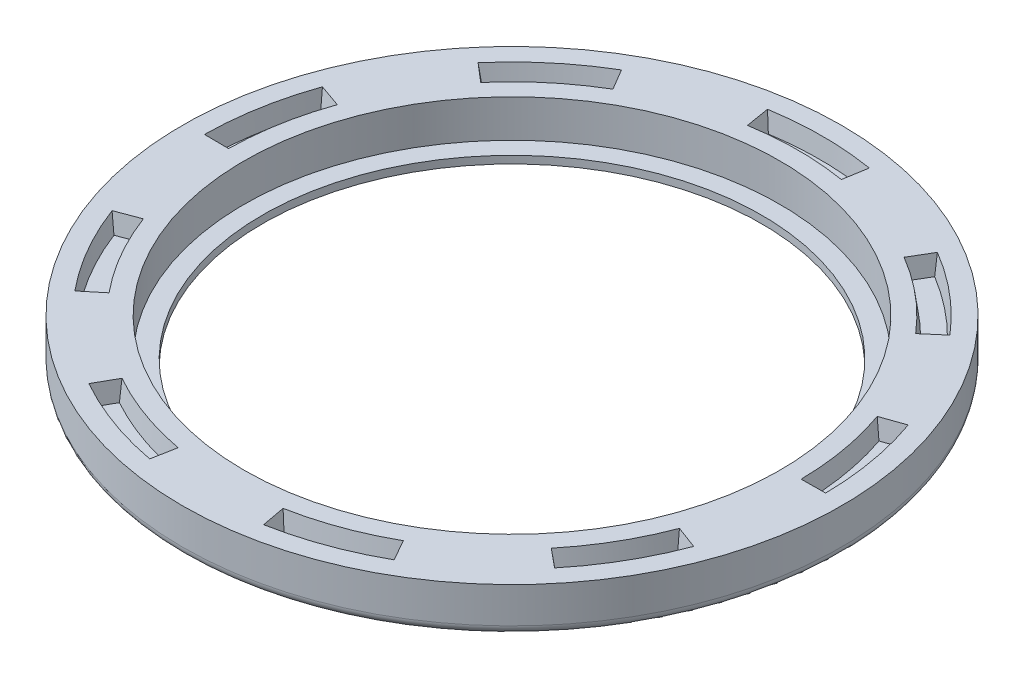
from build123d import *

# Parameters (mm, degrees)
SKETCH_1_R                    = 17.5
SKETCH_1_R_2                  = 13
EXTRUDE_1_DEPTH               = 2.4
SKETCH_2_R                    = 14.227604949
CUT_EXTRUDE_1_DEPTH           = 2
SKETCH_3_R                    = 13.25
CUT_EXTRUDE_2_DEPTH           = 2
CUT_EXTRUDE_3_DEPTH           = 1
CUT_EXTRUDE_3_DRAFT           = -8
CUT_EXTRUDE_3_PROFILE_2_DEPTH = 1
CUT_EXTRUDE_3_PROFILE_2_DRAFT = -8
CUT_EXTRUDE_3_PROFILE_3_DEPTH = 1
CUT_EXTRUDE_3_PROFILE_3_DRAFT = -8
CUT_EXTRUDE_3_PROFILE_4_DEPTH = 1
CUT_EXTRUDE_3_PROFILE_4_DRAFT = -8
CUT_EXTRUDE_3_PROFILE_5_DEPTH = 1
CUT_EXTRUDE_3_PROFILE_5_DRAFT = -8
CUT_EXTRUDE_3_PROFILE_6_DEPTH = 1
CUT_EXTRUDE_3_PROFILE_6_DRAFT = -8
CUT_EXTRUDE_3_PROFILE_7_DEPTH = 1
CUT_EXTRUDE_3_PROFILE_7_DRAFT = -8
CUT_EXTRUDE_3_PROFILE_8_DEPTH = 1
CUT_EXTRUDE_3_PROFILE_8_DRAFT = -8
CUT_EXTRUDE_3_PROFILE_9_DEPTH = 1
CUT_EXTRUDE_3_PROFILE_9_DRAFT = -8
FILLET_1_R                    = 0.5


with BuildPart() as part:
    # 草图1 → 凸台-拉伸1 (new body)
    with BuildSketch(Plane(origin=(0, 0, 0), x_dir=(1, 0, 0), z_dir=(0, 1, 0))):
        with Locations(Location((0, 0, 0), (0, 0, 270))):
            Circle(SKETCH_1_R)
        with Locations(Location((0, 0, 0), (0, 0, 270))):
            Circle(SKETCH_1_R_2, mode=Mode.SUBTRACT)
    extrude(amount=EXTRUDE_1_DEPTH)

    # 草图2 → 切除-拉伸1 (cut)
    with BuildSketch(Plane(origin=(0, 2.4, 0), x_dir=(1, 0, 0), z_dir=(0, 1, 0))):
        with Locations(Location((0, 0, 0), (0, 0, 270))):
            Circle(SKETCH_2_R)
    extrude(amount=-CUT_EXTRUDE_1_DEPTH, mode=Mode.SUBTRACT)

    # 草图3 → 切除-拉伸2 (cut)
    with BuildSketch(Plane(origin=(0, 0.4, 0), x_dir=(1, 0, 0), z_dir=(0, 1, 0))):
        with Locations(Location((0, 0, 0), (0, 0, 270))):
            Circle(SKETCH_3_R)
    extrude(amount=-CUT_EXTRUDE_2_DEPTH, mode=Mode.SUBTRACT)


with BuildPart() as cut_extrude_3_tool:
    # 草图4 → 切除-拉伸3 (with draft: the straight prism first)
    with BuildSketch(Plane(origin=(0, 2.4, 0), x_dir=(1, 0, 0), z_dir=(0, 1, 0))):
        with BuildLine():
            ThreePointArc((-2.491276454, 14.996396377), (0, 15.201919703), (2.491276454, 14.996396377))
            Line((2.491276454, 14.996396377), (2.702833077, 16.269874865))
            ThreePointArc((2.702833077, 16.269874865), (0, 16.49285102), (-2.702833077, 16.269874865))
            Line((-2.702833077, 16.269874865), (-2.491276454, 14.996396377))
        make_face()
    extrude(amount=-CUT_EXTRUDE_3_DEPTH)
    # 切除-拉伸3: the draft: its side faces are tilted about the plane it starts from
    cut_extrude_3_sides = [cut_extrude_3_tool.faces().sort_by_distance(p)[0] for p in [
        (0, 1.9, -16.49285102),
        (-2.597054766, 1.9, -15.633135621),
        (0, 1.9, -15.201919703),
        (2.597054766, 1.9, -15.633135621),
    ]]
    draft(cut_extrude_3_sides, Plane(origin=(0, 2.4, 0), x_dir=(1, 0, 0), z_dir=(0, 1, 0)), CUT_EXTRUDE_3_DRAFT)


with BuildPart() as part_1:
    add(part.part)

    # 切除-拉伸3: cut by cut_extrude_3_tool
    add(cut_extrude_3_tool.part, mode=Mode.SUBTRACT)


with BuildPart() as cut_extrude_3_profile_2_tool:
    # 草图4 → 切除-拉伸3 profile 2 (with draft: the straight prism first)
    with BuildSketch(Plane(origin=(0, 2.4, 0), x_dir=(1, 0, 0), z_dir=(0, 1, 0))):
        with BuildLine():
            ThreePointArc((7.731069297, 13.089267749), (9.771605629, 11.645346113), (11.547926265, 9.886544474))
            Line((11.547926265, 9.886544474), (12.528564234, 10.726099617))
            ThreePointArc((12.528564234, 10.726099617), (10.601400284, 12.634256875), (8.387583715, 14.200794844))
            Line((8.387583715, 14.200794844), (7.731069297, 13.089267749))
        make_face()
    extrude(amount=-CUT_EXTRUDE_3_PROFILE_2_DEPTH)
    # 切除-拉伸3 profile 2: the draft: its side faces are tilted about the plane it starts from
    cut_extrude_3_profile_2_sides = [cut_extrude_3_profile_2_tool.faces().sort_by_distance(p)[0] for p in [
        (8.059326506, 1.9, -13.645031296),
        (9.771605629, 1.9, -11.645346113),
        (12.03824525, 1.9, -10.306322046),
        (10.601400284, 1.9, -12.634256875),
    ]]
    draft(cut_extrude_3_profile_2_sides, Plane(origin=(0, 2.4, 0), x_dir=(1, 0, 0), z_dir=(0, 1, 0)), CUT_EXTRUDE_3_PROFILE_2_DRAFT)


with BuildPart() as part_2:
    add(part_1.part)

    # 切除-拉伸3 profile 2: cut by cut_extrude_3_profile_2_tool
    add(cut_extrude_3_profile_2_tool.part, mode=Mode.SUBTRACT)


with BuildPart() as cut_extrude_3_profile_3_tool:
    # 草图4 → 切除-拉伸3 profile 3 (with draft: the straight prism first)
    with BuildSketch(Plane(origin=(0, 2.4, 0), x_dir=(1, 0, 0), z_dir=(0, 1, 0))):
        with BuildLine():
            ThreePointArc((14.335961803, 5.05752527), (14.970968385, 2.639785654), (15.201173036, 0.150668535))
            Line((15.201173036, 0.150668535), (16.492040946, 0.163463152))
            ThreePointArc((16.492040946, 0.163463152), (16.242287554, 2.863953524), (15.553356869, 5.487005091))
            Line((15.553356869, 5.487005091), (14.335961803, 5.05752527))
        make_face()
    extrude(amount=-CUT_EXTRUDE_3_PROFILE_3_DEPTH)
    # 切除-拉伸3 profile 3: the draft: its side faces are tilted about the plane it starts from
    cut_extrude_3_profile_3_sides = [cut_extrude_3_profile_3_tool.faces().sort_by_distance(p)[0] for p in [
        (14.970968385, 1.9, -2.639785654),
        (15.846606991, 1.9, -0.157065843),
        (16.242287554, 1.9, -2.863953524),
        (14.944659336, 1.9, -5.27226518),
    ]]
    draft(cut_extrude_3_profile_3_sides, Plane(origin=(0, 2.4, 0), x_dir=(1, 0, 0), z_dir=(0, 1, 0)), CUT_EXTRUDE_3_PROFILE_3_DRAFT)


with BuildPart() as part_3:
    add(part_2.part)

    # 切除-拉伸3 profile 3: cut by cut_extrude_3_profile_3_tool
    add(cut_extrude_3_profile_3_tool.part, mode=Mode.SUBTRACT)


with BuildPart() as cut_extrude_3_profile_4_tool:
    # 草图4 → 切除-拉伸3 profile 4 (with draft: the straight prism first)
    with BuildSketch(Plane(origin=(0, 2.4, 0), x_dir=(1, 0, 0), z_dir=(0, 1, 0))):
        with BuildLine():
            ThreePointArc((14.232898455, -5.340689491), (13.165248649, -7.600959852), (11.741622, -9.655706886))
            Line((11.741622, -9.655706886), (12.738708411, -10.47565954))
            ThreePointArc((12.738708411, -10.47565954), (14.283227964, -8.24642551), (15.441541488, -5.794215325))
            Line((15.441541488, -5.794215325), (14.232898455, -5.340689491))
        make_face()
    extrude(amount=-CUT_EXTRUDE_3_PROFILE_4_DEPTH)
    # 切除-拉伸3 profile 4: the draft: its side faces are tilted about the plane it starts from
    cut_extrude_3_profile_4_sides = [cut_extrude_3_profile_4_tool.faces().sort_by_distance(p)[0] for p in [
        (12.240165206, 1.9, 10.065683213),
        (14.283227964, 1.9, 8.24642551),
        (14.837219972, 1.9, 5.567452408),
        (13.165248649, 1.9, 7.600959852),
    ]]
    draft(cut_extrude_3_profile_4_sides, Plane(origin=(0, 2.4, 0), x_dir=(1, 0, 0), z_dir=(0, 1, 0)), CUT_EXTRUDE_3_PROFILE_4_DRAFT)


with BuildPart() as part_4:
    add(part_3.part)

    # 切除-拉伸3 profile 4: cut by cut_extrude_3_profile_4_tool
    add(cut_extrude_3_profile_4_tool.part, mode=Mode.SUBTRACT)


with BuildPart() as cut_extrude_3_profile_5_tool:
    # 草图4 → 切除-拉伸3 profile 5 (with draft: the straight prism first)
    with BuildSketch(Plane(origin=(0, 2.4, 0), x_dir=(1, 0, 0), z_dir=(0, 1, 0))):
        with BuildLine():
            ThreePointArc((7.470103739, -13.239936284), (5.199362756, -14.285131767), (2.788035538, -14.944069744))
            Line((2.788035538, -14.944069744), (3.024792635, -16.213104708))
            ThreePointArc((3.024792635, -16.213104708), (5.64088727, -15.498210399), (8.104457231, -14.364257995))
            Line((8.104457231, -14.364257995), (7.470103739, -13.239936284))
        make_face()
    extrude(amount=-CUT_EXTRUDE_3_PROFILE_5_DEPTH)
    # 切除-拉伸3 profile 5: the draft: its side faces are tilted about the plane it starts from
    cut_extrude_3_profile_5_sides = [cut_extrude_3_profile_5_tool.faces().sort_by_distance(p)[0] for p in [
        (5.199362756, 1.9, 14.285131767),
        (2.906414086, 1.9, 15.578587226),
        (5.64088727, 1.9, 15.498210399),
        (7.787280485, 1.9, 13.80209714),
    ]]
    draft(cut_extrude_3_profile_5_sides, Plane(origin=(0, 2.4, 0), x_dir=(1, 0, 0), z_dir=(0, 1, 0)), CUT_EXTRUDE_3_PROFILE_5_DRAFT)


with BuildPart() as part_5:
    add(part_4.part)

    # 切除-拉伸3 profile 5: cut by cut_extrude_3_profile_5_tool
    add(cut_extrude_3_profile_5_tool.part, mode=Mode.SUBTRACT)


with BuildPart() as cut_extrude_3_profile_6_tool:
    # 草图4 → 切除-拉伸3 profile 6 (with draft: the straight prism first)
    with BuildSketch(Plane(origin=(0, 2.4, 0), x_dir=(1, 0, 0), z_dir=(0, 1, 0))):
        with BuildLine():
            ThreePointArc((-2.788035538, -14.944069744), (-5.199362756, -14.285131767), (-7.470103739, -13.239936284))
            Line((-7.470103739, -13.239936284), (-8.104457231, -14.364257995))
            ThreePointArc((-8.104457231, -14.364257995), (-5.64088727, -15.498210399), (-3.024792635, -16.213104708))
            Line((-3.024792635, -16.213104708), (-2.788035538, -14.944069744))
        make_face()
    extrude(amount=-CUT_EXTRUDE_3_PROFILE_6_DEPTH)
    # 切除-拉伸3 profile 6: the draft: its side faces are tilted about the plane it starts from
    cut_extrude_3_profile_6_sides = [cut_extrude_3_profile_6_tool.faces().sort_by_distance(p)[0] for p in [
        (-5.64088727, 1.9, 15.498210399),
        (-2.906414086, 1.9, 15.578587226),
        (-5.199362756, 1.9, 14.285131767),
        (-7.787280485, 1.9, 13.80209714),
    ]]
    draft(cut_extrude_3_profile_6_sides, Plane(origin=(0, 2.4, 0), x_dir=(1, 0, 0), z_dir=(0, 1, 0)), CUT_EXTRUDE_3_PROFILE_6_DRAFT)


with BuildPart() as part_6:
    add(part_5.part)

    # 切除-拉伸3 profile 6: cut by cut_extrude_3_profile_6_tool
    add(cut_extrude_3_profile_6_tool.part, mode=Mode.SUBTRACT)


with BuildPart() as cut_extrude_3_profile_7_tool:
    # 草图4 → 切除-拉伸3 profile 7 (with draft: the straight prism first)
    with BuildSketch(Plane(origin=(0, 2.4, 0), x_dir=(1, 0, 0), z_dir=(0, 1, 0))):
        with BuildLine():
            ThreePointArc((-11.741622, -9.655706886), (-13.165248649, -7.600959852), (-14.232898455, -5.340689491))
            Line((-14.232898455, -5.340689491), (-15.441541488, -5.794215325))
            ThreePointArc((-15.441541488, -5.794215325), (-14.283227964, -8.24642551), (-12.738708411, -10.47565954))
            Line((-12.738708411, -10.47565954), (-11.741622, -9.655706886))
        make_face()
    extrude(amount=-CUT_EXTRUDE_3_PROFILE_7_DEPTH)
    # 切除-拉伸3 profile 7: the draft: its side faces are tilted about the plane it starts from
    cut_extrude_3_profile_7_sides = [cut_extrude_3_profile_7_tool.faces().sort_by_distance(p)[0] for p in [
        (-12.240165206, 1.9, 10.065683213),
        (-13.165248649, 1.9, 7.600959852),
        (-14.837219972, 1.9, 5.567452408),
        (-14.283227964, 1.9, 8.24642551),
    ]]
    draft(cut_extrude_3_profile_7_sides, Plane(origin=(0, 2.4, 0), x_dir=(1, 0, 0), z_dir=(0, 1, 0)), CUT_EXTRUDE_3_PROFILE_7_DRAFT)


with BuildPart() as part_7:
    add(part_6.part)

    # 切除-拉伸3 profile 7: cut by cut_extrude_3_profile_7_tool
    add(cut_extrude_3_profile_7_tool.part, mode=Mode.SUBTRACT)


with BuildPart() as cut_extrude_3_profile_8_tool:
    # 草图4 → 切除-拉伸3 profile 8 (with draft: the straight prism first)
    with BuildSketch(Plane(origin=(0, 2.4, 0), x_dir=(1, 0, 0), z_dir=(0, 1, 0))):
        with BuildLine():
            ThreePointArc((-15.201173036, 0.150668535), (-14.970968385, 2.639785654), (-14.335961803, 5.05752527))
            Line((-14.335961803, 5.05752527), (-15.553356869, 5.487005091))
            ThreePointArc((-15.553356869, 5.487005091), (-16.242287554, 2.863953524), (-16.492040946, 0.163463152))
            Line((-16.492040946, 0.163463152), (-15.201173036, 0.150668535))
        make_face()
    extrude(amount=-CUT_EXTRUDE_3_PROFILE_8_DEPTH)
    # 切除-拉伸3 profile 8: the draft: its side faces are tilted about the plane it starts from
    cut_extrude_3_profile_8_sides = [cut_extrude_3_profile_8_tool.faces().sort_by_distance(p)[0] for p in [
        (-14.944659336, 1.9, -5.27226518),
        (-16.242287554, 1.9, -2.863953524),
        (-15.846606991, 1.9, -0.157065843),
        (-14.970968385, 1.9, -2.639785654),
    ]]
    draft(cut_extrude_3_profile_8_sides, Plane(origin=(0, 2.4, 0), x_dir=(1, 0, 0), z_dir=(0, 1, 0)), CUT_EXTRUDE_3_PROFILE_8_DRAFT)


with BuildPart() as part_8:
    add(part_7.part)

    # 切除-拉伸3 profile 8: cut by cut_extrude_3_profile_8_tool
    add(cut_extrude_3_profile_8_tool.part, mode=Mode.SUBTRACT)


with BuildPart() as cut_extrude_3_profile_9_tool:
    # 草图4 → 切除-拉伸3 profile 9 (with draft: the straight prism first)
    with BuildSketch(Plane(origin=(0, 2.4, 0), x_dir=(1, 0, 0), z_dir=(0, 1, 0))):
        with BuildLine():
            ThreePointArc((-11.547926265, 9.886544474), (-9.771605629, 11.645346113), (-7.731069297, 13.089267749))
            Line((-7.731069297, 13.089267749), (-8.387583715, 14.200794844))
            ThreePointArc((-8.387583715, 14.200794844), (-10.601400284, 12.634256875), (-12.528564234, 10.726099617))
            Line((-12.528564234, 10.726099617), (-11.547926265, 9.886544474))
        make_face()
    extrude(amount=-CUT_EXTRUDE_3_PROFILE_9_DEPTH)
    # 切除-拉伸3 profile 9: the draft: its side faces are tilted about the plane it starts from
    cut_extrude_3_profile_9_sides = [cut_extrude_3_profile_9_tool.faces().sort_by_distance(p)[0] for p in [
        (-10.601400284, 1.9, -12.634256875),
        (-12.03824525, 1.9, -10.306322046),
        (-9.771605629, 1.9, -11.645346113),
        (-8.059326506, 1.9, -13.645031296),
    ]]
    draft(cut_extrude_3_profile_9_sides, Plane(origin=(0, 2.4, 0), x_dir=(1, 0, 0), z_dir=(0, 1, 0)), CUT_EXTRUDE_3_PROFILE_9_DRAFT)


with BuildPart() as part_9:
    add(part_8.part)

    # 切除-拉伸3 profile 9: cut by cut_extrude_3_profile_9_tool
    add(cut_extrude_3_profile_9_tool.part, mode=Mode.SUBTRACT)

    # 圆角1
    fillet_1_edges = [part_9.edges().sort_by_distance(p)[0] for p in [
        (0, 0, -17.5),
    ]]
    fillet(fillet_1_edges, radius=FILLET_1_R)


solid = part_9.part
